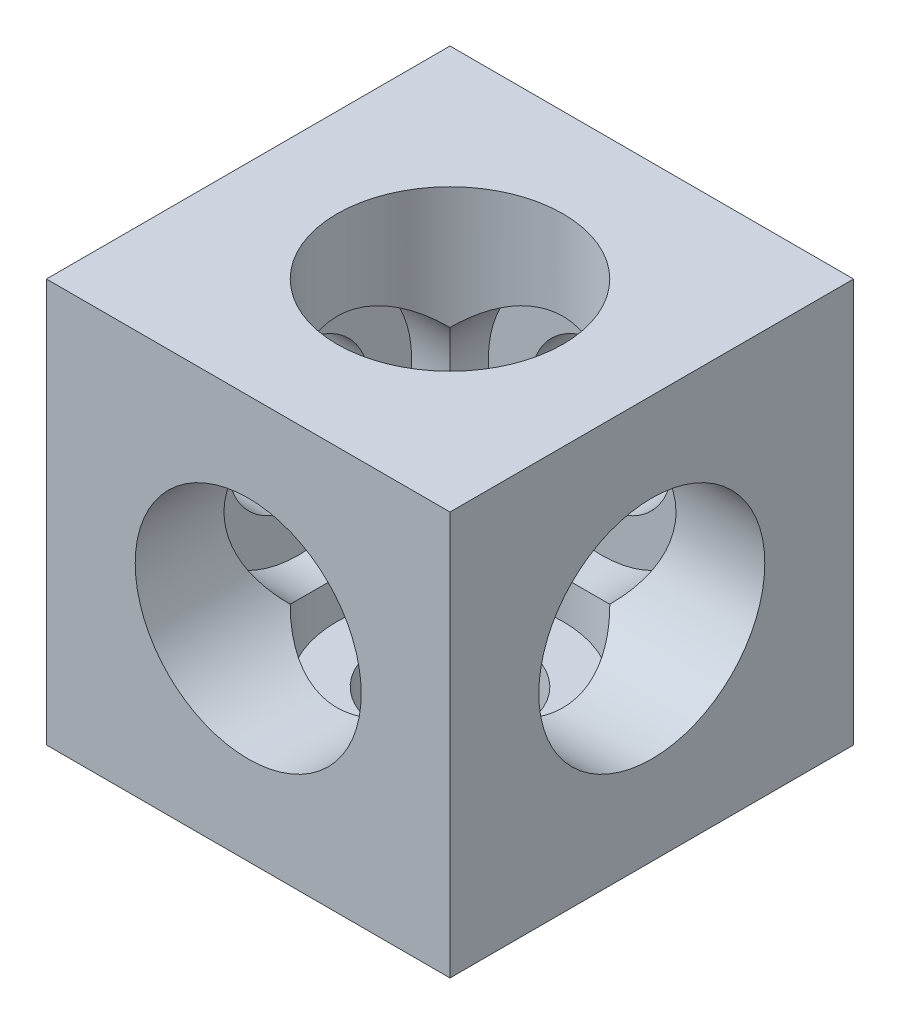
from build123d import *

# Parameters (mm, degrees)
SKETCH1_W           = 20
SKETCH1_H           = 20
BOSS_EXTRUDE1_DEPTH = 20
HOLE1_D             = 7
HOLE1_CBORE_D       = 11.2
HOLE1_CBORE_DEPTH   = 17.5
HOLE2_D             = 7
HOLE2_CBORE_D       = 11.2
HOLE2_CBORE_DEPTH   = 17.5


with BuildPart() as part:
    # Sketch1 → Boss-Extrude1 (new body)
    with BuildSketch(Plane(origin=(0, 10, 0), x_dir=(1, 0, 0), z_dir=(0, 1, 0))):
        Rectangle(SKETCH1_W, SKETCH1_H)
    extrude(amount=-BOSS_EXTRUDE1_DEPTH)

    # Sketch2 → Cut-Revolve1 (revolve, cut)
    with BuildSketch(Plane(origin=(0, 0, 0), x_dir=(-1, 0, 0), z_dir=(0, 0, -1)), mode=Mode.PRIVATE) as cut_revolve1_sk:
        Polygon((-3.5, -10), (0, -10), (0, 10), (-5.6, 10), (-5.6, -7.5), (-3.5, -7.5), align=None)
    revolve(cut_revolve1_sk.sketch.rotate(Axis((0, -10, 0), (0, 1, 0)), 180), axis=Axis((0, -10, 0), (0, 1, 0)), mode=Mode.SUBTRACT)

    # Hole1 (through all)
    with Locations(Plane.XY.offset(10)):
        with Locations((0, 0)):
            CounterBoreHole(HOLE1_D / 2, HOLE1_CBORE_D / 2, HOLE1_CBORE_DEPTH)

    # Hole2 (through all)
    with Locations(Plane(origin=(10, 0, 0), x_dir=(0, 0, -1), z_dir=(1, 0, 0))):
        with Locations((0, 0)):
            CounterBoreHole(HOLE2_D / 2, HOLE2_CBORE_D / 2, HOLE2_CBORE_DEPTH)


solid = part.part
